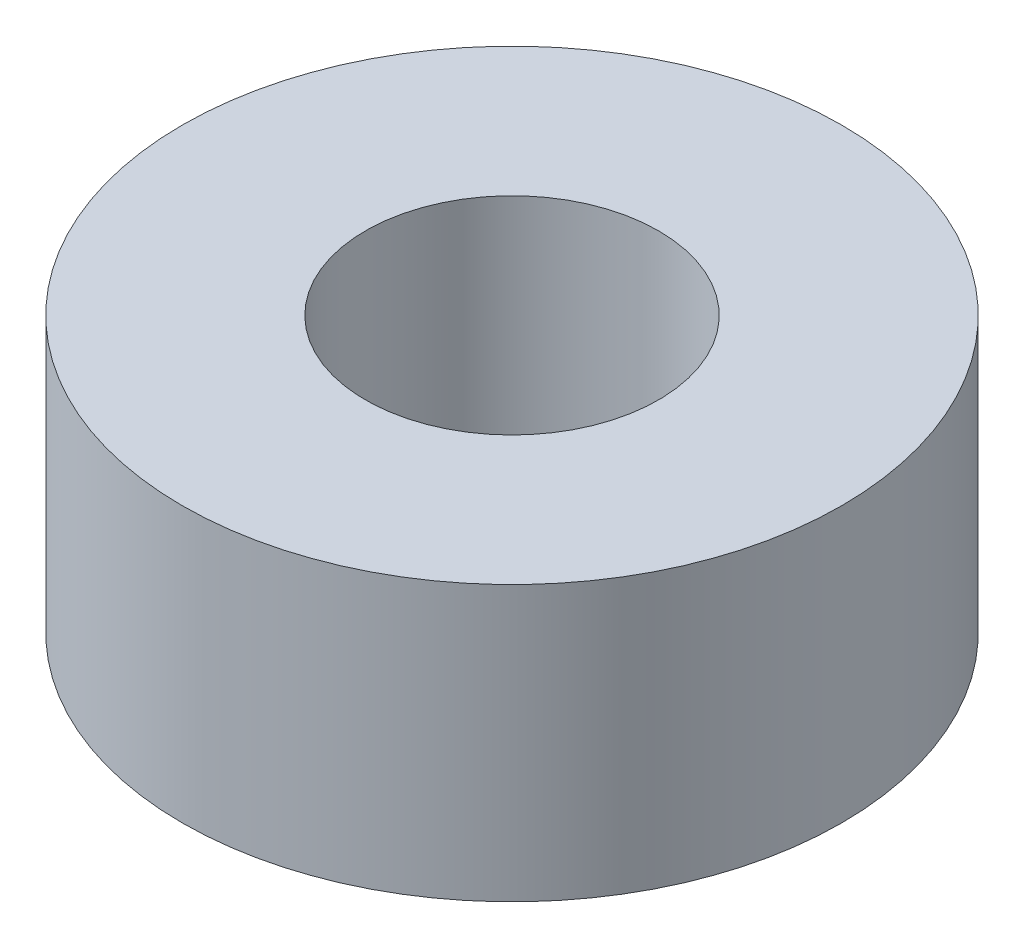
from build123d import *

# Parameters (mm, degrees)
SZKIC2_W = 2
SZKIC2_H = 3


with BuildPart() as part:
    # Szkic2 → Obrót1 (revolve)
    with BuildSketch(Plane.XY, mode=Mode.PRIVATE) as obr_t1_sk:
        with Locations((2.6, 1.5)):
            Rectangle(SZKIC2_W, SZKIC2_H)
    revolve(obr_t1_sk.sketch.rotate(Axis((0, 0, 0), (0, 1, 0)), 90), axis=Axis((0, 0, 0), (0, 1, 0)))


solid = part.part
